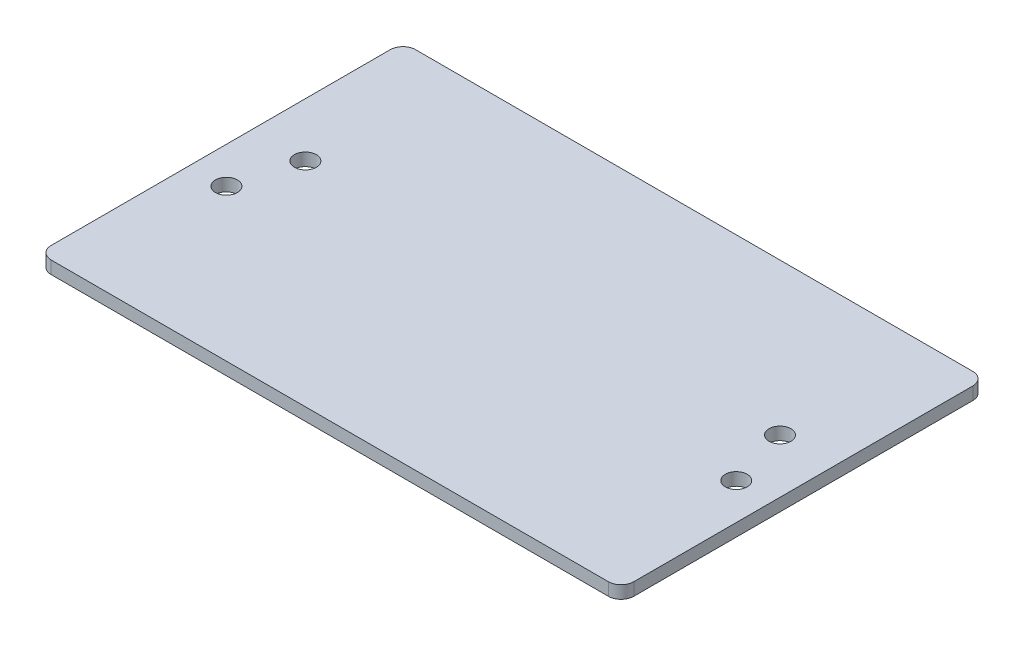
from build123d import *

# Parameters (mm, degrees)
SKETCH1_W           = 146.05
SKETCH1_H           = 91.35
SKETCH1_R           = 2.75
BOSS_EXTRUDE1_DEPTH = 3.175
FILLET1_R           = 3.175


with BuildPart() as part:
    # Sketch1 → Boss-Extrude1 (new body)
    with BuildSketch(Plane(origin=(0, 0, 0), x_dir=(1, 0, 0), z_dir=(0, 1, 0))):
        with Locations((73.025, 45.675)):
            Rectangle(SKETCH1_W, SKETCH1_H)
        with Locations(Location((13.525, 53.3650935, 0), (0, 0, 270))):
            Circle(SKETCH1_R, mode=Mode.SUBTRACT)
        with Locations(Location((9.114802, 37.9849065, 0), (0, 0, 270))):
            Circle(SKETCH1_R, mode=Mode.SUBTRACT)
        with Locations(Location((132.525, 53.3650935, 0), (0, 0, 270))):
            Circle(SKETCH1_R, mode=Mode.SUBTRACT)
        with Locations(Location((136.935198, 37.9849065, 0), (0, 0, 270))):
            Circle(SKETCH1_R, mode=Mode.SUBTRACT)
    extrude(amount=BOSS_EXTRUDE1_DEPTH)

    # Fillet1
    fillet1_edges = [part.edges().sort_by_distance(p)[0] for p in [
        (0, 1.5875, -91.35),
        (146.05, 1.5875, -91.35),
        (146.05, 1.5875, 0),
        (0, 1.5875, 0),
    ]]
    fillet(fillet1_edges, radius=FILLET1_R)


solid = part.part
